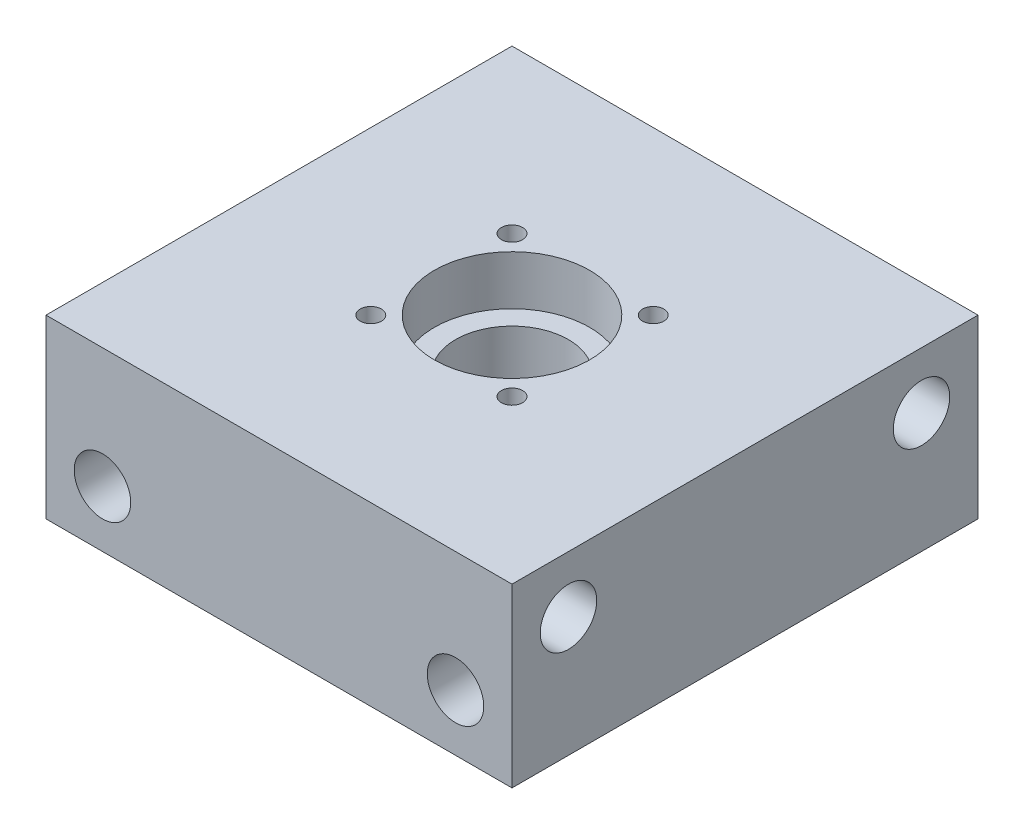
from build123d import *

# Parameters (mm, degrees)
SKETCH1_W           = 66
SKETCH1_H           = 66
SKETCH1_R           = 11
SKETCH1_R_2         = 1.5
BOSS_EXTRUDE1_DEPTH = 25
SKETCH1_4_R         = 11
SKETCH1_4_R_2       = 8
BOSS_EXTRUDE2_DEPTH = 18
SKETCH2_R           = 4
CUT_EXTRUDE1_DEPTH  = 78.910204723
SKETCH3_R           = 4
CUT_EXTRUDE2_DEPTH  = 78.910204723
SKETCH1_5_R         = 1.5
CUT_EXTRUDE3_DEPTH  = 2.5


with BuildPart() as part:
    # Sketch1 → Boss-Extrude1 (new body)
    with BuildSketch(Plane(origin=(0, 0, 0), x_dir=(1, 0, 0), z_dir=(0, 1, 0))):
        Rectangle(SKETCH1_W, SKETCH1_H)
        Circle(SKETCH1_R, mode=Mode.SUBTRACT)
        with Locations((10, 10)):
            Circle(SKETCH1_R_2, mode=Mode.SUBTRACT)
        with Locations((-10, -10)):
            Circle(SKETCH1_R_2, mode=Mode.SUBTRACT)
        with Locations((10, -10)):
            Circle(SKETCH1_R_2, mode=Mode.SUBTRACT)
        with Locations((-10, 10)):
            Circle(SKETCH1_R_2, mode=Mode.SUBTRACT)
    extrude(amount=BOSS_EXTRUDE1_DEPTH)

    # Sketch1<4> → Boss-Extrude2 (add)
    with BuildSketch(Plane(origin=(0, 0, 0), x_dir=(1, 0, 0), z_dir=(0, 1, 0))):
        Circle(SKETCH1_4_R)
        Circle(SKETCH1_4_R_2, mode=Mode.SUBTRACT)
    extrude(amount=BOSS_EXTRUDE2_DEPTH)

    # Sketch2 → Cut-Extrude1 (cut, through all)
    with BuildSketch(Plane.ZY.offset(33)):
        with Locations((-25, 17)):
            Circle(SKETCH2_R)
        with Locations((25, 17)):
            Circle(SKETCH2_R)
    extrude(amount=-CUT_EXTRUDE1_DEPTH, mode=Mode.SUBTRACT)

    # Sketch3 → Cut-Extrude2 (cut, through all)
    with BuildSketch(Plane(origin=(0, 0, -33), x_dir=(-1, 0, 0), z_dir=(0, 0, -1))):
        with Locations((-25, 8)):
            Circle(SKETCH3_R)
        with Locations((25, 8)):
            Circle(SKETCH3_R)
    extrude(amount=-CUT_EXTRUDE2_DEPTH, mode=Mode.SUBTRACT)

    # Sketch1<5> → Cut-Extrude3 (cut)
    # profile 1 of 4: a face of its own
    with BuildSketch(Plane(origin=(0, 0, 0), x_dir=(1, 0, 0), z_dir=(0, 1, 0))):
        Polygon((11.616580754, 7.2), (13.233161507, 10), (11.616580754, 12.8), (8.383419246, 12.8), (6.766838493, 10), (8.383419246, 7.2), align=None)
        with Locations((10, 10)):
            Circle(SKETCH1_5_R, mode=Mode.SUBTRACT)
    # profile 2 of 4: a face of its own
    with BuildSketch(Plane(origin=(0, 0, 0), x_dir=(1, 0, 0), z_dir=(0, 1, 0))):
        Polygon((-8.383419246, 7.2), (-6.766838493, 10), (-8.383419246, 12.8), (-11.616580754, 12.8), (-13.233161507, 10), (-11.616580754, 7.2), align=None)
        with Locations((-10, 10)):
            Circle(SKETCH1_5_R, mode=Mode.SUBTRACT)
    # profile 3 of 4: a face of its own
    with BuildSketch(Plane(origin=(0, 0, 0), x_dir=(1, 0, 0), z_dir=(0, 1, 0))):
        Polygon((11.616580754, -12.8), (13.233161507, -10), (11.616580754, -7.2), (8.383419246, -7.2), (6.766838493, -10), (8.383419246, -12.8), align=None)
        with Locations((10, -10)):
            Circle(SKETCH1_5_R, mode=Mode.SUBTRACT)
    # profile 4 of 4: a face of its own
    with BuildSketch(Plane(origin=(0, 0, 0), x_dir=(1, 0, 0), z_dir=(0, 1, 0))):
        Polygon((-8.383419246, -12.8), (-6.766838493, -10), (-8.383419246, -7.2), (-11.616580754, -7.2), (-13.233161507, -10), (-11.616580754, -12.8), align=None)
        with Locations((-10, -10)):
            Circle(SKETCH1_5_R, mode=Mode.SUBTRACT)
    extrude(amount=CUT_EXTRUDE3_DEPTH, mode=Mode.SUBTRACT)


solid = part.part
